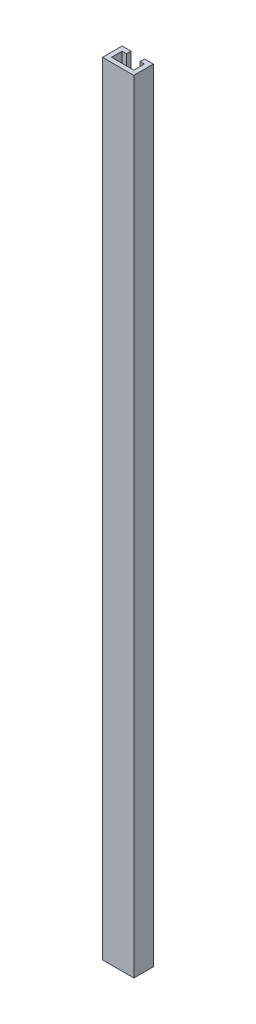
from build123d import *

# Parameters (mm, degrees)
EXTRUDE_1_DEPTH = 200


with BuildPart() as part:
    # 草图1 → 凸台-拉伸1 (new body)
    with BuildSketch(Plane(origin=(0, 0, 0), x_dir=(1, 0, 0), z_dir=(0, 1, 0))):
        Polygon((0, -5), (8, -5), (8, 0), (5.75, 0), (5.75, -1.15), (6.85, -1.15), (6.85, -3.85), (1.15, -3.85), (1.15, -1.15), (2.25, -1.15), (2.25, 0), (0, 0), align=None)
    extrude(amount=EXTRUDE_1_DEPTH)


solid = part.part
